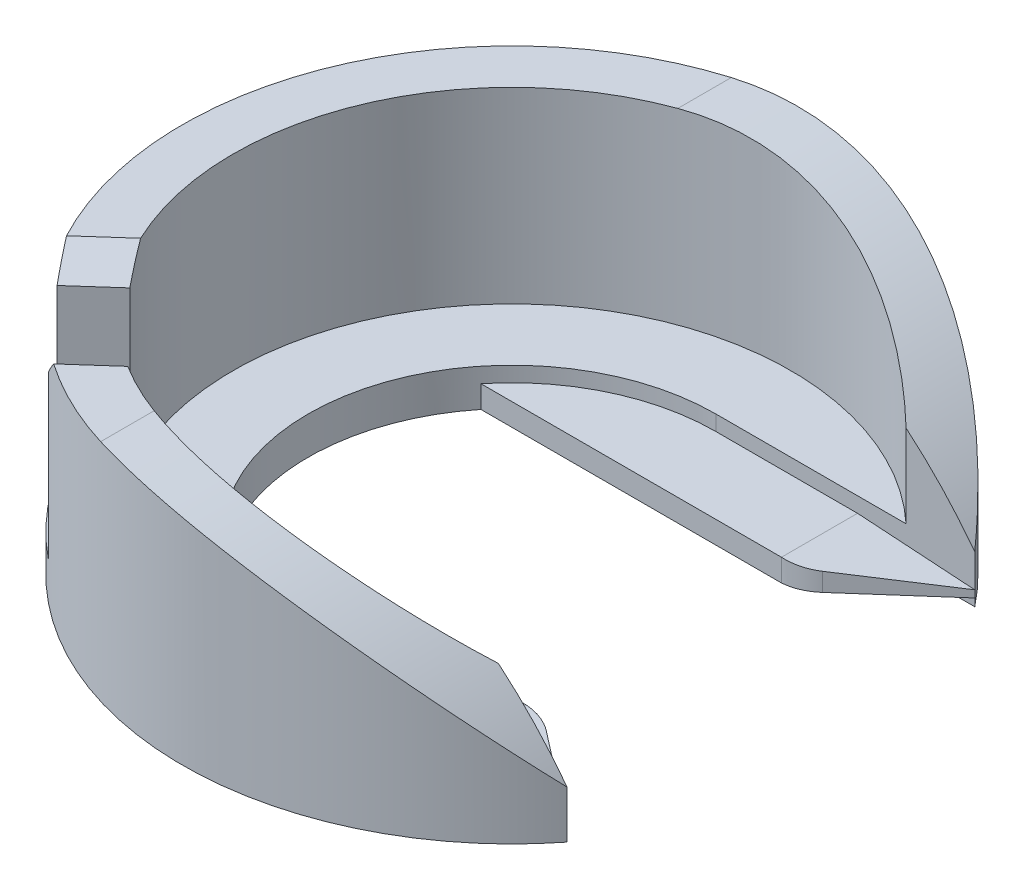
from build123d import *

# Parameters (mm, degrees)
BOSS_EXTRUDE1_DEPTH     = 4.4
BOSS_EXTRUDE2_START     = 4.4
BOSS_EXTRUDE2_DEPTH     = 40
BOSS_EXTRUDE3_START     = 4.4
BOSS_EXTRUDE3_DEPTH     = 3
CUT_EXTRUDE1_START      = -37
CUT_EXTRUDE1_DEPTH      = 37
CHAMFER1_SIZE           = 5
CUT_EXTRUDE2_DEPTH      = 120.718001988
CUT_EXTRUDE2_DEPTH_BACK = 120.718001988
FILLET1_R               = 10
CUT_EXTRUDE3_START      = -15
CUT_EXTRUDE3_DEPTH      = 80.4


with BuildPart() as part:
    # Sketch1 → Boss-Extrude1 (new body)
    with BuildSketch(Plane(origin=(0, 0, 0), x_dir=(1, 0, 0), z_dir=(0, 1, 0))):
        with BuildLine():
            Line((-31.320919527, 25.2), (31.320919527, 25.2))
            Line((31.320919527, 25.2), (51.0779796, 40.2))
            ThreePointArc((51.0779796, 40.2), (-65, 0), (51.0779796, -40.2))
            Line((51.0779796, -40.2), (31.320919527, -25.2))
            Line((31.320919527, -25.2), (-31.320919527, -25.2))
            ThreePointArc((-31.320919527, -25.2), (-40.2, 0), (-31.320919527, 25.2))
        make_face()
    extrude(amount=BOSS_EXTRUDE1_DEPTH)

    # Sketch1<3> → Boss-Extrude2 (add)
    with BuildSketch(Plane(origin=(0, 0, 0), x_dir=(1, 0, 0), z_dir=(0, 1, 0)).offset(BOSS_EXTRUDE2_START)):
        with BuildLine():
            ThreePointArc((37.536115942, -40.2), (-21.914762413, -50.445447648), (-55, 0))
            Line((-55, 0), (-65, 0))
            ThreePointArc((-65, 0), (-21.271240279, -61.420960079), (51.0779796, -40.2))
            Line((51.0779796, -40.2), (37.536115942, -40.2))
        make_face()
        with BuildLine():
            ThreePointArc((-55, 0), (-21.914762413, 50.445447648), (37.536115942, 40.2))
            Line((37.536115942, 40.2), (51.0779796, 40.2))
            ThreePointArc((51.0779796, 40.2), (-21.271240279, 61.420960079), (-65, 0))
            Line((-65, 0), (-55, 0))
        make_face()
    extrude(amount=BOSS_EXTRUDE2_DEPTH)

    # Sketch1<4> → Boss-Extrude3 (add)
    with BuildSketch(Plane(origin=(0, 0, 0), x_dir=(1, 0, 0), z_dir=(0, 1, 0)).offset(BOSS_EXTRUDE3_START)):
        with BuildLine():
            ThreePointArc((-40.2, 0), (-37.915306704, 13.359248389), (-31.320919527, 25.2))
            ThreePointArc((-31.320919527, 25.2), (-17.363755354, 36.256585609), (0, 40.2))
            Line((0, 40.2), (37.536115942, 40.2))
            ThreePointArc((37.536115942, 40.2), (-21.914762413, 50.445447648), (-55, 0))
            Line((-55, 0), (-40.2, 0))
        make_face()
        with BuildLine():
            ThreePointArc((-31.320919527, -25.2), (-37.915306704, -13.359248389), (-40.2, 0))
            Line((-40.2, 0), (-55, 0))
            ThreePointArc((-55, 0), (-21.914762413, -50.445447648), (37.536115942, -40.2))
            Line((37.536115942, -40.2), (0, -40.2))
            ThreePointArc((0, -40.2), (-17.363755354, -36.256585609), (-31.320919527, -25.2))
        make_face()
    extrude(amount=BOSS_EXTRUDE3_DEPTH)

    # Sketch2 → Cut-Extrude1 (cut)
    with BuildSketch(Plane(origin=(0, 44.4, 0), x_dir=(1, 0, 0), z_dir=(0, 1, 0)).offset(CUT_EXTRUDE1_START)):
        with BuildLine():
            Line((-47.304535151, -28.058527299), (-54.891163788, -34.813217864))
            ThreePointArc((-54.891163788, -34.813217864), (-48.54657249, -43.223029736), (-40.926800335, -50.49749513))
            Line((-40.926800335, -50.49749513), (-33.340171698, -43.742804564))
            ThreePointArc((-33.340171698, -43.742804564), (-41.07786903, -36.573332853), (-47.304535151, -28.058527299))
        make_face()
    extrude(amount=CUT_EXTRUDE1_DEPTH, mode=Mode.SUBTRACT)

    # Chamfer1
    chamfer1_edges = [part.edges().sort_by_distance(p)[0] for p in [
        (-51.097849469, 44.4, 31.435872581),
        (-37.133486016, 44.4, 47.120149847),
    ]]
    chamfer(chamfer1_edges, length=CHAMFER1_SIZE)

    # Sketch3 → Cut-Extrude2 (cut, two sides: drawn at the far end of the back side and taken through both)
    with BuildSketch(Plane.XY.offset(-25.2).offset(-CUT_EXTRUDE2_DEPTH_BACK)):
        with BuildLine():
            Line((51.0779796, 44.4), (-18.9220204, 44.4))
            ThreePointArc((-18.9220204, 44.4), (20.209169206, 35.162379212), (51.0779796, 9.4))
            Line((51.0779796, 9.4), (51.0779796, 44.4))
        make_face()
    extrude(amount=CUT_EXTRUDE2_DEPTH + CUT_EXTRUDE2_DEPTH_BACK, mode=Mode.SUBTRACT)

    # Fillet1
    fillet1_edges = [part.edges().sort_by_distance(p)[0] for p in [
        (31.320919527, 2.2, -25.2),
        (31.320919527, 2.2, 25.2),
    ]]
    fillet(fillet1_edges, radius=FILLET1_R)

    # Sketch4 → Cut-Extrude3 (cut)
    with BuildSketch(Plane.XY.offset(-25.2).offset(CUT_EXTRUDE3_START)):
        Polygon((51.0779796, 4.4), (27.954908691, 4.4), (51.0779796, 2.9), align=None)
        Polygon((51.0779796, 0), (51.0779796, 1.5), (27.954908691, 0), align=None)
    extrude(amount=CUT_EXTRUDE3_DEPTH, mode=Mode.SUBTRACT)


solid = part.part
